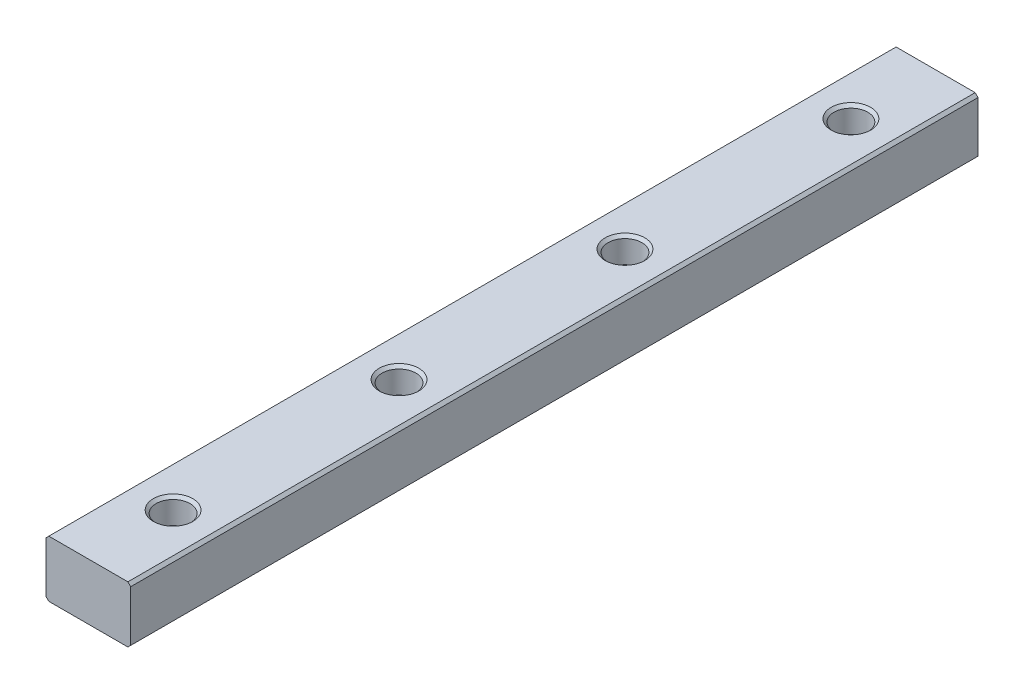
from build123d import *

# Parameters (mm, degrees)
SKETCH1_W                  = 15
SKETCH1_H                  = 10
BOSS_EXTRUDE1_DEPTH        = 75
SKETCH2_R                  = 3
CUT_EXTRUDE1_DEPTH         = 4.5
SKETCH3_R                  = 1.75
CUT_EXTRUDE2_DEPTH         = 76.574466588
CHAMFER1_SIZE              = 0.5
LPATTERN1_COUNT            = 4
LPATTERN1_PITCH            = 40
CHAMFER1_OF_LPATTERN1_SIZE = 0.5
CHAMFER2_SIZE              = 0.5


with BuildPart() as part:
    # Sketch1 → Boss-Extrude1 (new, symmetric)
    with BuildSketch(Plane.XY):
        Rectangle(SKETCH1_W, SKETCH1_H)
    extrude(amount=BOSS_EXTRUDE1_DEPTH, both=True)

    # Sketch2 → Cut-Extrude1 (cut)
    with BuildSketch(Plane(origin=(0, 5, 0), x_dir=(1, 0, 0), z_dir=(0, 1, 0))):
        with Locations(Location((0, -60, 0), (0, 0, 180))):
            Circle(SKETCH2_R)
    cut_extrude1 = extrude(amount=-CUT_EXTRUDE1_DEPTH, mode=Mode.SUBTRACT)

    # Sketch3 → Cut-Extrude2 (cut, through all)
    with BuildSketch(Plane(origin=(0, 0.5, 0), x_dir=(1, 0, 0), z_dir=(0, 1, 0))):
        with Locations(Location((0, -60, 0), (0, 0, 180))):
            Circle(SKETCH3_R)
    cut_extrude2 = extrude(amount=-CUT_EXTRUDE2_DEPTH, mode=Mode.SUBTRACT)

    # Chamfer1
    chamfer1_edges = [part.edges().sort_by_distance(p)[0] for p in [
        (3, 5, 60),
        (1.75, -5, 60),
    ]]
    chamfer(chamfer1_edges, length=CHAMFER1_SIZE)

    # LPattern1: Cut-Extrude1, Cut-Extrude2 ×4
    with Locations(*[(0, 0, -i * LPATTERN1_PITCH) for i in range(1, LPATTERN1_COUNT)]):
        add(cut_extrude1, mode=Mode.SUBTRACT)
        add(cut_extrude2, mode=Mode.SUBTRACT)

    # Chamfer1 of LPattern1
    chamfer1_of_lpattern1_edges = [part.edges().sort_by_distance(p)[0] for p in [
        (3, 5, 20),
        (1.75, -5, 20),
        (3, 5, -20),
        (1.75, -5, -20),
        (3, 5, -60),
        (1.75, -5, -60),
    ]]
    chamfer(chamfer1_of_lpattern1_edges, length=CHAMFER1_OF_LPATTERN1_SIZE)

    # Chamfer2
    chamfer2_edges = [part.edges().sort_by_distance(p)[0] for p in [
        (-7.5, 5, 0),
        (7.5, 5, 0),
        (7.5, -5, 0),
        (-7.5, -5, 0),
    ]]
    chamfer(chamfer2_edges, length=CHAMFER2_SIZE)


solid = part.part
